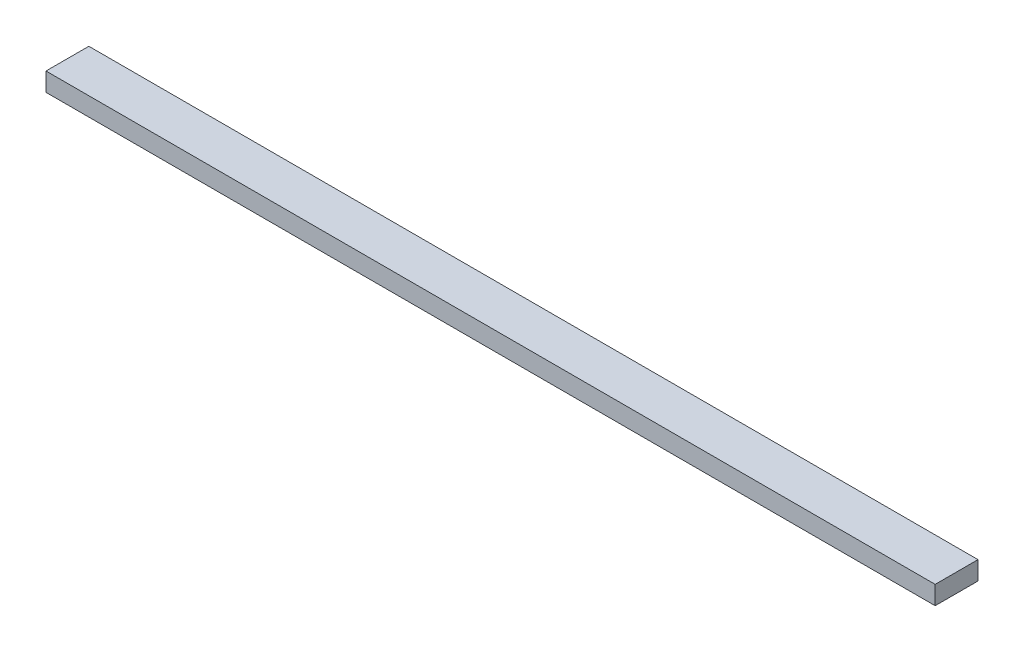
from build123d import *

# Parameters (mm, degrees)
SKETCH1_W           = 88.10625
SKETCH1_H           = 38.1
BOSS_EXTRUDE1_DEPTH = 1828.8


with BuildPart() as part:
    # Sketch1 → Boss-Extrude1 (new body)
    with BuildSketch(Plane(origin=(0, 0, 0), x_dir=(0, 0, -1), z_dir=(1, 0, 0))):
        Rectangle(SKETCH1_W, SKETCH1_H)
    extrude(amount=BOSS_EXTRUDE1_DEPTH)


solid = part.part
